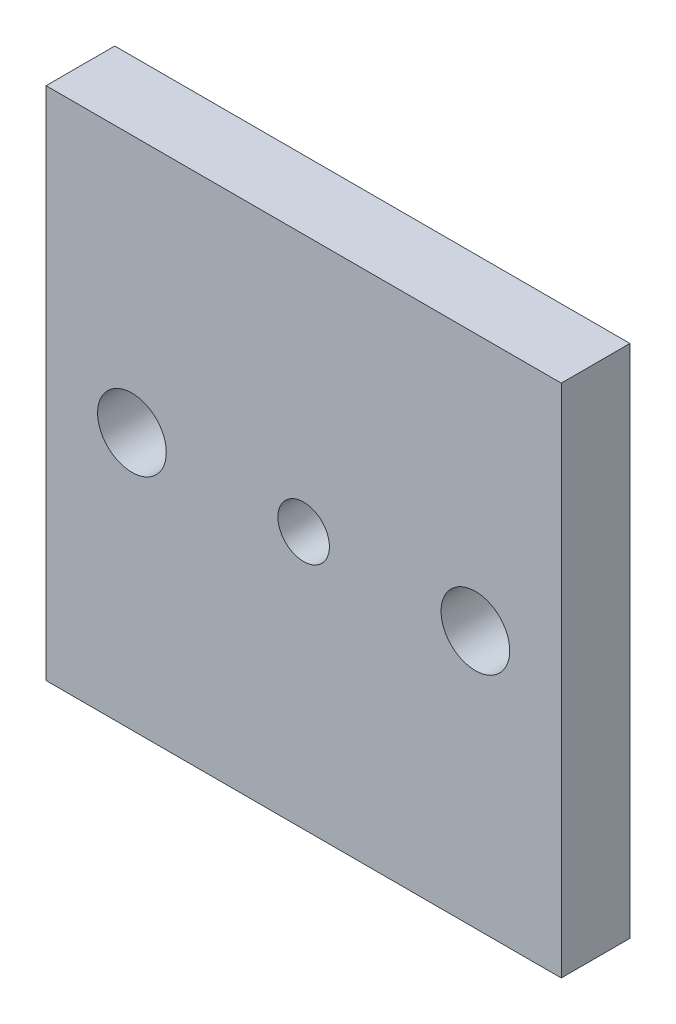
from build123d import *

# Parameters (mm, degrees)
BOSS_EXTRUDE1_DEPTH = 4


with BuildPart() as part:
    # Sketch1 → Boss-Extrude1 (new body)
    with BuildSketch(Plane.XY):
        with BuildLine():
            ThreePointArc((2.5, -15), (15, -2.5), (27.5, -15))
            Line((27.5, -15), (30, -15))
            Line((30, -15), (30, 0))
            Line((30, 0), (0, 0))
            Line((0, 0), (0, -15))
            Line((0, -15), (2.5, -15))
        make_face()
        with BuildLine():
            Line((30, -15), (27.5, -15))
            ThreePointArc((27.5, -15), (15, -27.5), (2.5, -15))
            Line((2.5, -15), (0, -15))
            Line((0, -15), (0, -30))
            Line((0, -30), (30, -30))
            Line((30, -30), (30, -15))
        make_face()
        with BuildLine():
            ThreePointArc((23, -15), (25, -13), (27, -15))
            Line((27, -15), (27.5, -15))
            ThreePointArc((27.5, -15), (15, -2.5), (2.5, -15))
            Line((2.5, -15), (3, -15))
            ThreePointArc((3, -15), (5, -13), (7, -15))
            Line((7, -15), (13.5, -15))
            ThreePointArc((13.5, -15), (15, -13.5), (16.5, -15))
            Line((16.5, -15), (23, -15))
        make_face()
        with BuildLine():
            Line((27.5, -15), (27, -15))
            ThreePointArc((27, -15), (25, -17), (23, -15))
            Line((23, -15), (16.5, -15))
            ThreePointArc((16.5, -15), (15, -16.5), (13.5, -15))
            Line((13.5, -15), (7, -15))
            ThreePointArc((7, -15), (5, -17), (3, -15))
            Line((3, -15), (2.5, -15))
            ThreePointArc((2.5, -15), (15, -27.5), (27.5, -15))
        make_face()
    extrude(amount=BOSS_EXTRUDE1_DEPTH)


solid = part.part
